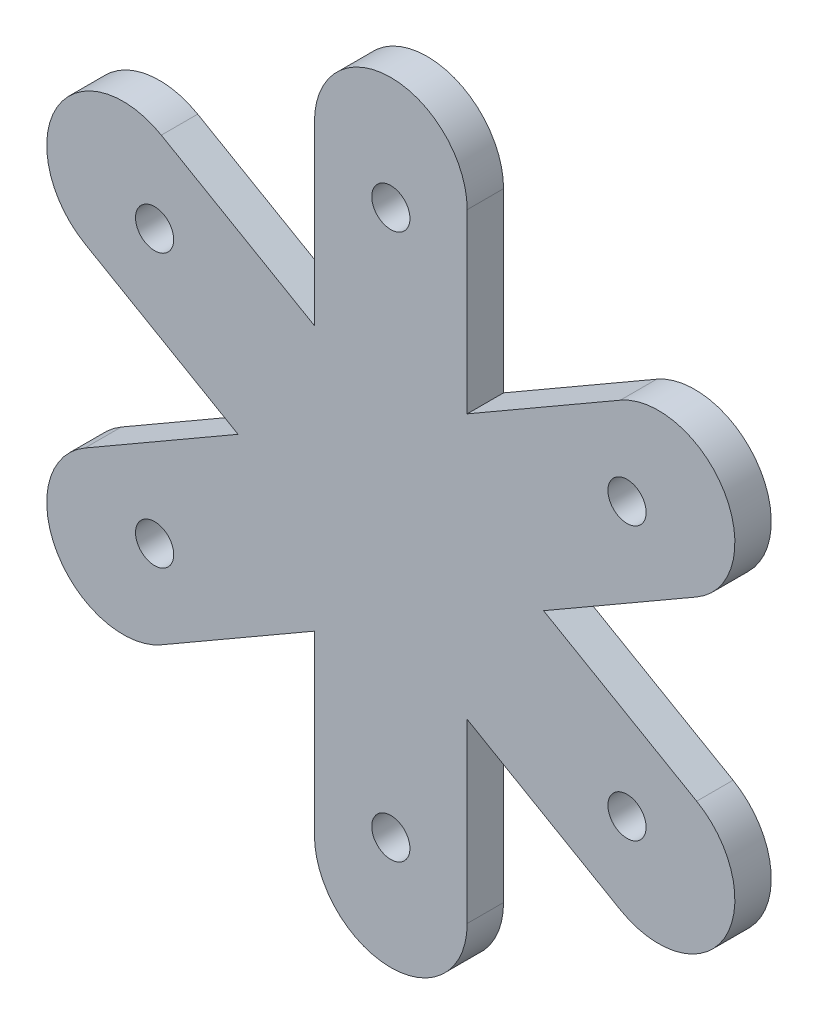
from build123d import *

# Parameters (mm, degrees)
SKETCH_1_R      = 5.25
EXTRUDE_1_DEPTH = 10


with BuildPart() as part:
    # 草图1 → 凸台-拉伸1 (new body)
    with BuildSketch(Plane.XY):
        with BuildLine():
            Line((21, 0), (21, -48.626933041))
            Line((21, -48.626933041), (63.112159322, -24.313466521))
            ThreePointArc((63.112159322, -24.313466521), (91.798692801, -32), (84.112159322, -60.686533479))
            Line((84.112159322, -60.686533479), (42, -85))
            Line((42, -85), (84.112159322, -109.313466521))
            ThreePointArc((84.112159322, -109.313466521), (91.798692801, -138), (63.112159322, -145.686533479))
            Line((63.112159322, -145.686533479), (21, -121.373066959))
            Line((21, -121.373066959), (21, -170))
            ThreePointArc((21, -170), (0, -191), (-21, -170))
            Line((-21, -170), (-21, -121.373066959))
            Line((-21, -121.373066959), (-63.112159322, -145.686533479))
            ThreePointArc((-63.112159322, -145.686533479), (-91.798692801, -138), (-84.112159322, -109.313466521))
            Line((-84.112159322, -109.313466521), (-42, -85))
            Line((-42, -85), (-84.112159322, -60.686533479))
            ThreePointArc((-84.112159322, -60.686533479), (-91.798692801, -32), (-63.112159322, -24.313466521))
            Line((-63.112159322, -24.313466521), (-21, -48.626933041))
            Line((-21, -48.626933041), (-21, 0))
            ThreePointArc((-21, 0), (0, 21), (21, 0))
        make_face()
        with Locations((0, -10)):
            Circle(SKETCH_1_R, mode=Mode.SUBTRACT)
        with Locations((64.951905284, -47.5)):
            Circle(SKETCH_1_R, mode=Mode.SUBTRACT)
        with Locations((64.951905284, -122.5)):
            Circle(SKETCH_1_R, mode=Mode.SUBTRACT)
        with Locations((0, -160)):
            Circle(SKETCH_1_R, mode=Mode.SUBTRACT)
        with Locations((-64.951905284, -122.5)):
            Circle(SKETCH_1_R, mode=Mode.SUBTRACT)
        with Locations((-64.951905284, -47.5)):
            Circle(SKETCH_1_R, mode=Mode.SUBTRACT)
    extrude(amount=EXTRUDE_1_DEPTH)


solid = part.part
